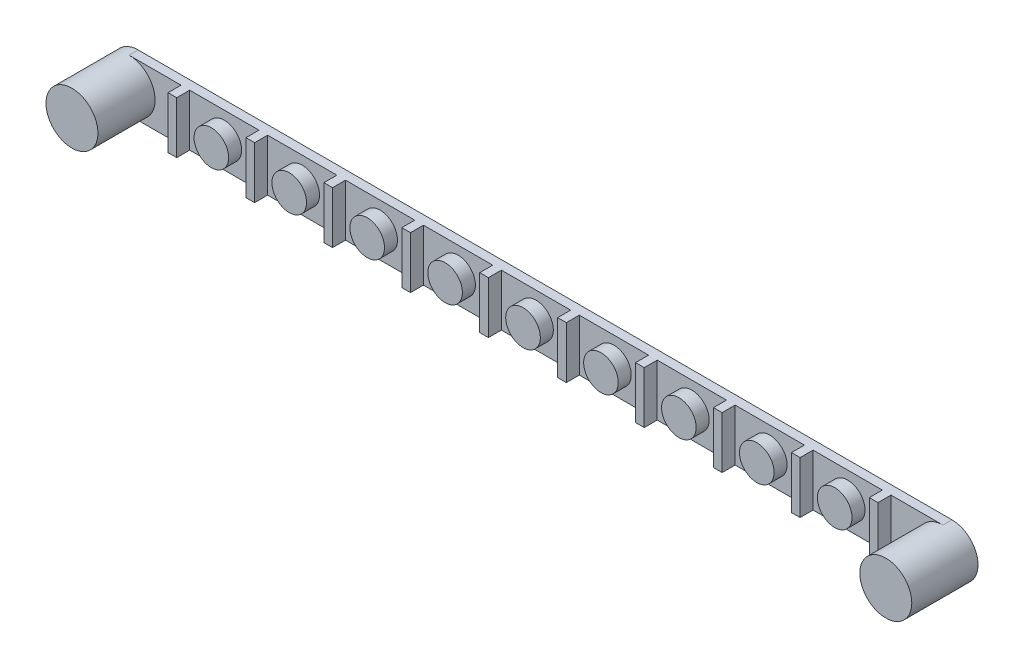
from build123d import *

# Parameters (mm, degrees)
EXTRUDE_1_DEPTH = 2.1
SKETCH_2_R      = 6
EXTRUDE_2_DEPTH = 13.2
SKETCH_3_R      = 4
SKETCH_3_W      = 2
SKETCH_3_H      = 12
EXTRUDE_3_DEPTH = 3


with BuildPart() as part:
    # Эскиз1 → Бобышка-Вытянуть1 (new body)
    with BuildSketch(Plane.XY):
        with BuildLine():
            Line((-94, 6), (94, 6))
            ThreePointArc((94, 6), (100, 0), (94, -6))
            Line((94, -6), (-94, -6))
            ThreePointArc((-94, -6), (-100, 0), (-94, 6))
        make_face()
    extrude(amount=EXTRUDE_1_DEPTH)

    # Эскиз2 → Бобышка-Вытянуть2 (add)
    with BuildSketch(Plane.XY.offset(2.1)):
        with Locations(Location((-94, 0, 0), (0, 0, 270))):
            Circle(SKETCH_2_R)
        with Locations(Location((94, 0, 0), (0, 0, 90))):
            Circle(SKETCH_2_R)
    extrude(amount=EXTRUDE_2_DEPTH)

    # Эскиз3 → Бобышка-Вытянуть3 (add)
    with BuildSketch(Plane.XY.offset(2.1)):
        with Locations((-72, 0)):
            Circle(SKETCH_3_R)
        with Locations((-36, 0)):
            Circle(SKETCH_3_R)
        Circle(SKETCH_3_R)
        with Locations((36, 0)):
            Circle(SKETCH_3_R)
        with Locations((72, 0)):
            Circle(SKETCH_3_R)
        with Locations((-54, 0)):
            Circle(SKETCH_3_R)
        with Locations((-18, 0)):
            Circle(SKETCH_3_R)
        with Locations((18, 0)):
            Circle(SKETCH_3_R)
        with Locations((54, 0)):
            Circle(SKETCH_3_R)
        with Locations((-81, 0)):
            Rectangle(SKETCH_3_W, SKETCH_3_H)
        with Locations((-63, 0)):
            Rectangle(SKETCH_3_W, SKETCH_3_H)
        with Locations((-45, 0)):
            Rectangle(SKETCH_3_W, SKETCH_3_H)
        with Locations((-27, 0)):
            Rectangle(SKETCH_3_W, SKETCH_3_H)
        with Locations((-9, 0)):
            Rectangle(SKETCH_3_W, SKETCH_3_H)
        with Locations((9, 0)):
            Rectangle(SKETCH_3_W, SKETCH_3_H)
        with Locations((27, 0)):
            Rectangle(SKETCH_3_W, SKETCH_3_H)
        with Locations((45, 0)):
            Rectangle(SKETCH_3_W, SKETCH_3_H)
        with Locations((63, 0)):
            Rectangle(SKETCH_3_W, SKETCH_3_H)
        with Locations((81, 0)):
            Rectangle(SKETCH_3_W, SKETCH_3_H)
    extrude(amount=EXTRUDE_3_DEPTH)


solid = part.part
